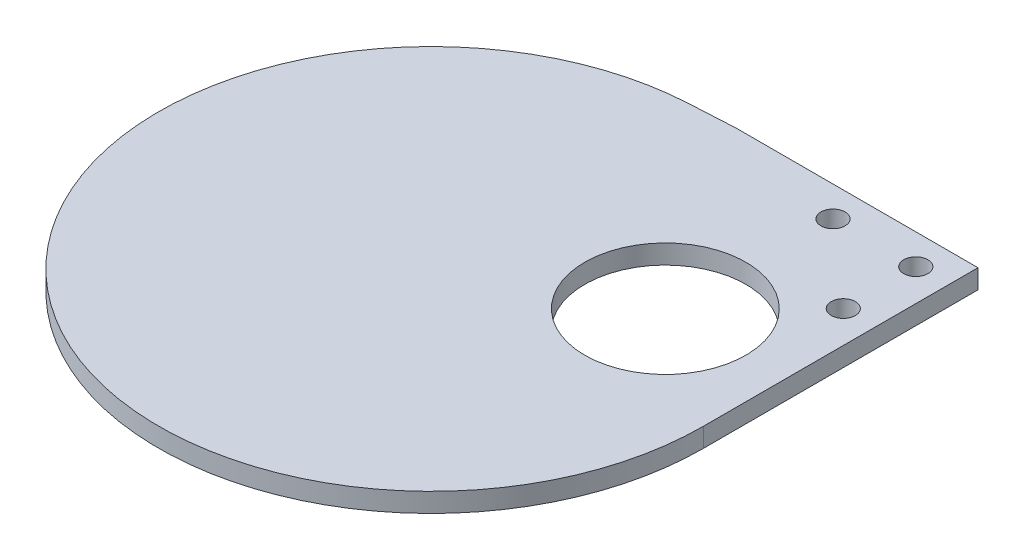
from build123d import *

# Parameters (mm, degrees)
SKETCH1_R           = 13.335
BOSS_EXTRUDE1_DEPTH = 3.175
CUT_EXTRUDE1_REACH  = 93.585
SKETCH2_R           = 2


with BuildPart() as part:
    # Sketch1 → Boss-Extrude1 (new body)
    with BuildSketch(Plane(origin=(0, 0, 0), x_dir=(1, 0, 0), z_dir=(0, 1, 0))):
        with BuildLine():
            Line((-20.000000005, 31.75), (-27.57263297, 31.331531049))
            ThreePointArc((-27.57263297, 31.331531049), (-56.072919353, -46.432398987), (20.000000005, -13.684787183))
            Line((20.000000005, -13.684787183), (20.000000005, 31.75))
            Line((20.000000005, 31.75), (-20.000000005, 31.75))
        make_face()
        with Locations(Location((0, 0, 0), (0, 0, 270))):
            Circle(SKETCH1_R, mode=Mode.SUBTRACT)
    extrude(amount=BOSS_EXTRUDE1_DEPTH)

    # Sketch2 → Cut-Extrude1 (cut, up to next)
    with BuildSketch(Plane.XZ, mode=Mode.PRIVATE) as cut_extrude1_sk1:
        with Locations(Location((14.706006433, -14.75, 0), (0, 0, 270))):
            Circle(SKETCH2_R)
    cut_extrude1_tool1 = extrude(cut_extrude1_sk1.sketch, amount=-CUT_EXTRUDE1_REACH, mode=Mode.PRIVATE) & part.part
    # Sketch2 → Cut-Extrude1 (cut, up to next)
    with BuildSketch(Plane.XZ, mode=Mode.PRIVATE) as cut_extrude1_sk2:
        with Locations(Location((14.706006433, -26.75, 0), (0, 0, 270))):
            Circle(SKETCH2_R)
    cut_extrude1_tool2 = extrude(cut_extrude1_sk2.sketch, amount=-CUT_EXTRUDE1_REACH, mode=Mode.PRIVATE) & part.part
    # Sketch2 → Cut-Extrude1 (cut, up to next)
    with BuildSketch(Plane.XZ, mode=Mode.PRIVATE) as cut_extrude1_sk3:
        with Locations(Location((1, -26.75, 0), (0, 0, 270))):
            Circle(SKETCH2_R)
    cut_extrude1_tool3 = extrude(cut_extrude1_sk3.sketch, amount=-CUT_EXTRUDE1_REACH, mode=Mode.PRIVATE) & part.part
    add(cut_extrude1_tool1.solids().sort_by_distance((14.706006, 0, -14.75))[0], mode=Mode.SUBTRACT)
    add(cut_extrude1_tool2.solids().sort_by_distance((14.706006, 0, -26.75))[0], mode=Mode.SUBTRACT)
    add(cut_extrude1_tool3.solids().sort_by_distance((1, 0, -26.75))[0], mode=Mode.SUBTRACT)


solid = part.part
